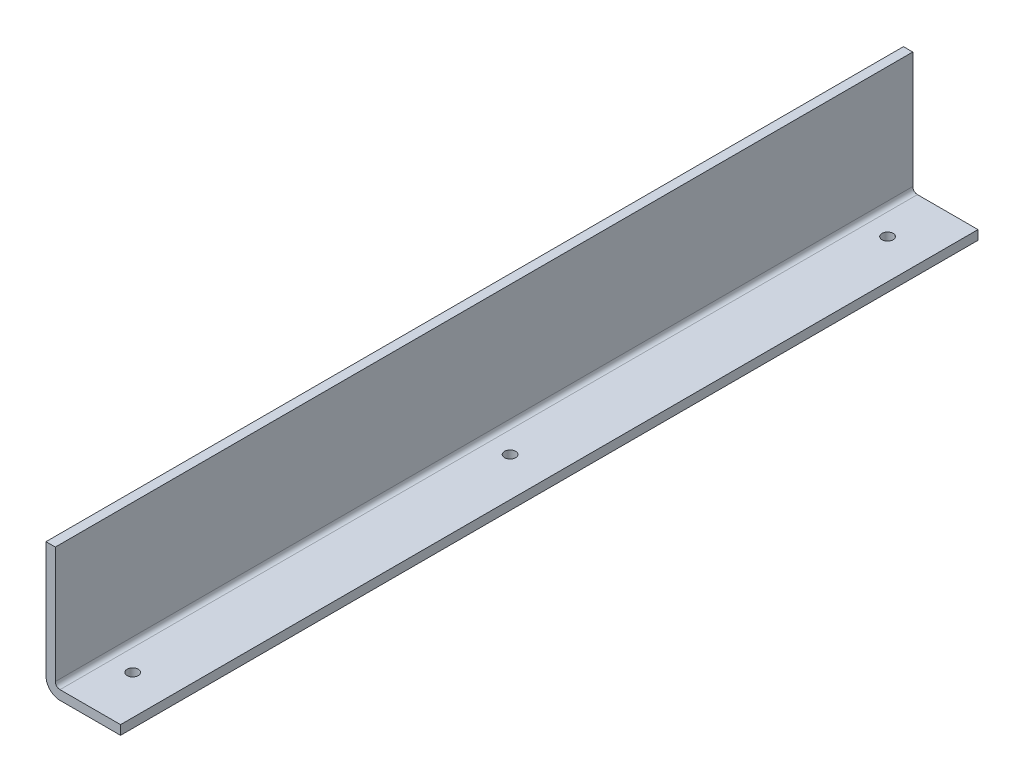
from build123d import *

# Parameters (mm, degrees)
EXTRUDE_1_DEPTH            = 460
SKETCH_2_W                 = 6
SKETCH_2_H                 = 10
PATTERN_LINEAR_1_COUNT     = 2
PATTERN_LINEAR_1_PITCH     = 405
PATTERN_LINEAR_1_COL_COUNT = 2
PATTERN_LINEAR_1_COL_PITCH = 405


with BuildPart() as part:
    # 草图1 → 凸台-拉伸1 (new, symmetric)
    with BuildSketch(Plane.XY):
        with BuildLine():
            Line((0, 140), (0, 15))
            ThreePointArc((0, 15), (4.393398282, 4.393398282), (15, 0))
            Line((15, 0), (80, 0))
            Line((80, 0), (80, 10))
            Line((80, 10), (15, 10))
            ThreePointArc((15, 10), (11.464466094, 11.464466094), (10, 15))
            Line((10, 15), (10, 140))
            Line((10, 140), (0, 140))
        make_face()
    extrude(amount=EXTRUDE_1_DEPTH, both=True)

    # 草图2 → 切除-旋转1 (revolve, cut)
    with BuildSketch(Plane.XY, mode=Mode.PRIVATE) as cut_revolve_1_sk:
        with Locations((41, 5)):
            Rectangle(SKETCH_2_W, SKETCH_2_H)
    cut_revolve_1 = revolve(cut_revolve_1_sk.sketch.rotate(Axis((38, 38.728286981, 0), (0, -1, 0)), 180), axis=Axis((38, 38.728286981, 0), (0, -1, 0)), mode=Mode.SUBTRACT)

    # 阵列(线性)1: 切除-旋转1 ×2
    with Locations(*[(0, 0, i * PATTERN_LINEAR_1_PITCH) for i in range(1, PATTERN_LINEAR_1_COUNT)]):
        add(cut_revolve_1, mode=Mode.SUBTRACT)

    # 阵列(线性)1 col: 切除-旋转1 ×2
    with Locations(*[(0, 0, -i * PATTERN_LINEAR_1_COL_PITCH) for i in range(1, PATTERN_LINEAR_1_COL_COUNT)]):
        add(cut_revolve_1, mode=Mode.SUBTRACT)


solid = part.part
